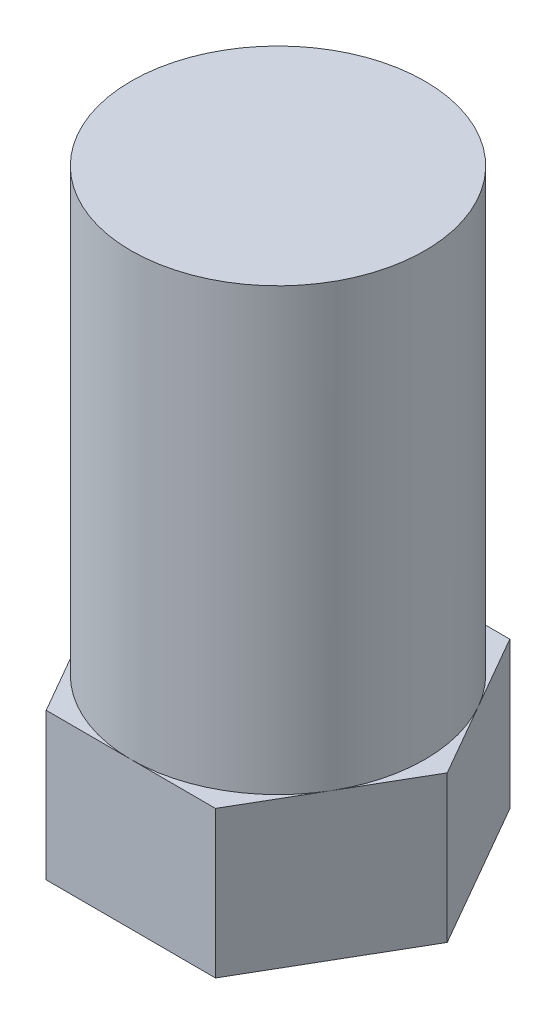
from build123d import *

# Parameters (mm, degrees)
SALIENTE_EXTRUIR1_DEPTH = 5
CROQUIS2_R              = 5
SALIENTE_EXTRUIR2_DEPTH = 15


with BuildPart() as part:
    # Croquis1 → Saliente-Extruir1 (new body)
    with BuildSketch(Plane(origin=(0, 0, 0), x_dir=(1, 0, 0), z_dir=(0, 1, 0))):
        Polygon((2.897074319, 4.994025803), (-2.876416054, 5.005952858), (-5.773490372, 0.011927055), (-2.897074319, -4.994025803), (2.876416054, -5.005952858), (5.773490372, -0.011927055), align=None)
    extrude(amount=SALIENTE_EXTRUIR1_DEPTH)

    # Croquis2 → Saliente-Extruir2 (add)
    with BuildSketch(Plane(origin=(0, 5, 0), x_dir=(1, 0, 0), z_dir=(0, 1, 0))):
        with Locations(Location((0, 0, 0), (0, 0, 89.881636776))):
            Circle(CROQUIS2_R)
    extrude(amount=SALIENTE_EXTRUIR2_DEPTH)


solid = part.part
